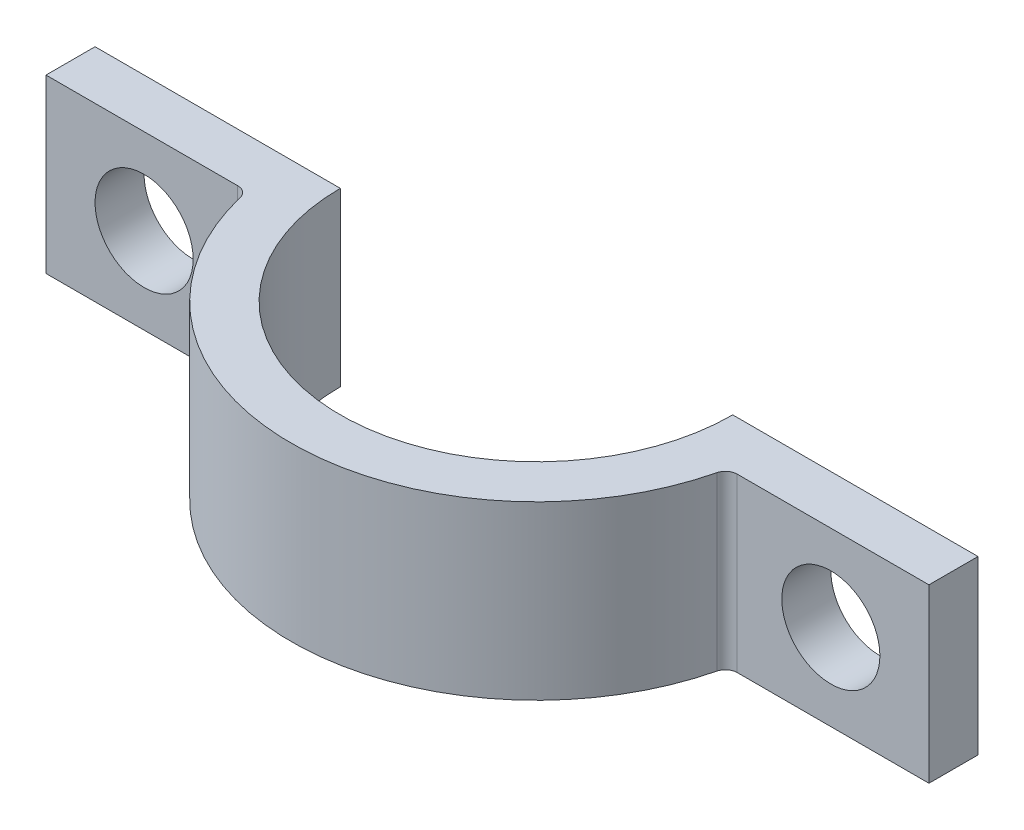
from build123d import *

# Parameters (mm, degrees)
BOSS_EXTRUDE1_DEPTH = 5.5626
SKETCH2_R           = 3.175
CUT_EXTRUDE1_DEPTH  = 32.761031843


with BuildPart() as part:
    # Sketch1 → Boss-Extrude1 (new, symmetric)
    with BuildSketch(Plane(origin=(0, 0, 0), x_dir=(1, 0, 0), z_dir=(0, 1, 0))):
        with BuildLine():
            Line((-12.7, 0), (-28.575, 0))
            Line((-28.575, 0), (-28.575, -3.175))
            Line((-28.575, -3.175), (-16.164461018, -3.175))
            ThreePointArc((-16.164461018, -3.175), (-15.693695846, -3.337813758), (-15.424104025, -3.756679389))
            ThreePointArc((-15.424104025, -3.756679389), (0, -15.875), (15.424104025, -3.756679389))
            ThreePointArc((15.424104025, -3.756679389), (15.693695846, -3.337813758), (16.164461018, -3.175))
            Line((16.164461018, -3.175), (28.575, -3.175))
            Line((28.575, -3.175), (28.575, 0))
            Line((28.575, 0), (12.7, 0))
            ThreePointArc((12.7, 0), (0, -12.7), (-12.7, 0))
        make_face()
    extrude(amount=BOSS_EXTRUDE1_DEPTH, both=True)

    # Sketch2 → Cut-Extrude1 (cut, through all)
    with BuildSketch(Plane.XY.offset(3.175)):
        with Locations((-22.225, 0)):
            Circle(SKETCH2_R)
        with Locations((22.225, 0)):
            Circle(SKETCH2_R)
    extrude(amount=-CUT_EXTRUDE1_DEPTH, mode=Mode.SUBTRACT)


solid = part.part
